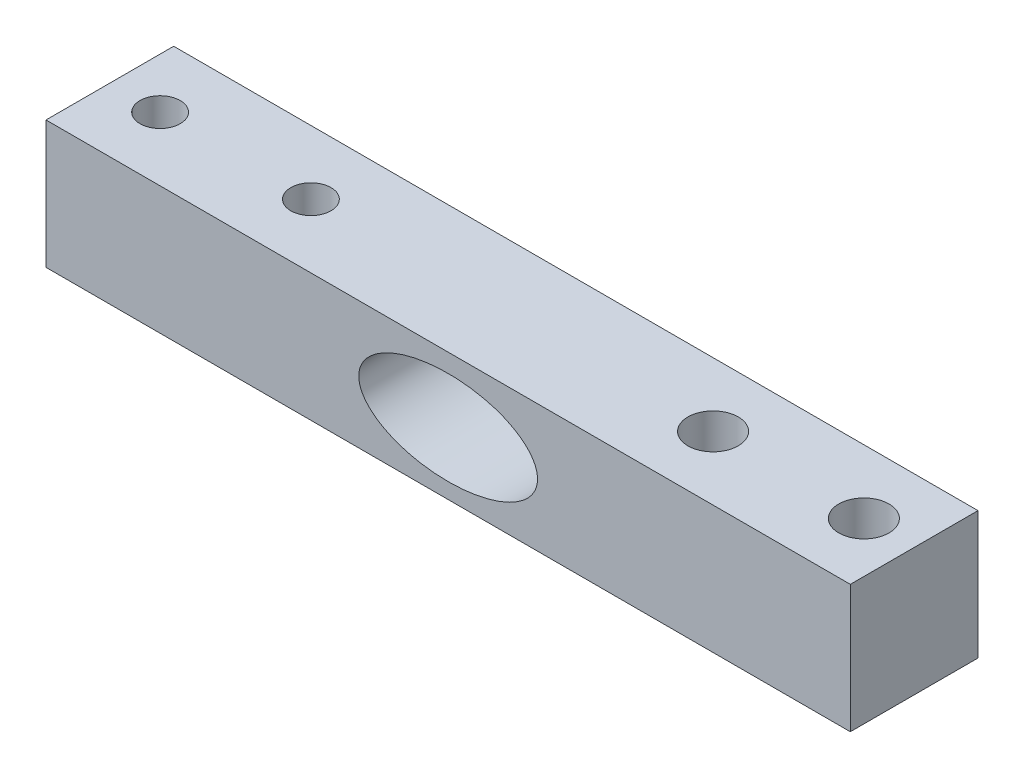
from build123d import *

# Parameters (mm, degrees)
SKETCH2_W           = 80
SKETCH2_H           = 12.7
BOSS_EXTRUDE1_DEPTH = 12.7
SKETCH3_R           = 2
SKETCH3_R_2         = 2.5
CUT_EXTRUDE1_DEPTH  = 43.445406112
SKETCH4_RX          = 8.89
SKETCH4_RY          = 4.6609
CUT_EXTRUDE3_DEPTH  = 44.847234804


with BuildPart() as part:
    # Sketch2 → Boss-Extrude1 (new body)
    with BuildSketch(Plane(origin=(0, 0, 0), x_dir=(1, 0, 0), z_dir=(0, 1, 0))):
        Rectangle(SKETCH2_W, SKETCH2_H)
    extrude(amount=BOSS_EXTRUDE1_DEPTH)

    # Sketch3 → Cut-Extrude1 (cut, through all)
    with BuildSketch(Plane(origin=(0, 12.7, 0), x_dir=(1, 0, 0), z_dir=(0, 1, 0))):
        with Locations(Location((-35, 0, 0), (0, 0, 270))):
            Circle(SKETCH3_R)
        with Locations(Location((-20, 0, 0), (0, 0, 270))):
            Circle(SKETCH3_R)
        with Locations(Location((35, 0, 0), (0, 0, 270))):
            Circle(SKETCH3_R_2)
        with Locations(Location((20, 0, 0), (0, 0, 270))):
            Circle(SKETCH3_R_2)
    extrude(amount=-CUT_EXTRUDE1_DEPTH, mode=Mode.SUBTRACT)

    # Sketch4 → Cut-Extrude3 (cut, through all)
    with BuildSketch(Plane.XY.offset(6.35)):
        with Locations((0, 6.20775407)):
            Ellipse(SKETCH4_RX, SKETCH4_RY)
    extrude(amount=-CUT_EXTRUDE3_DEPTH, mode=Mode.SUBTRACT)


solid = part.part
